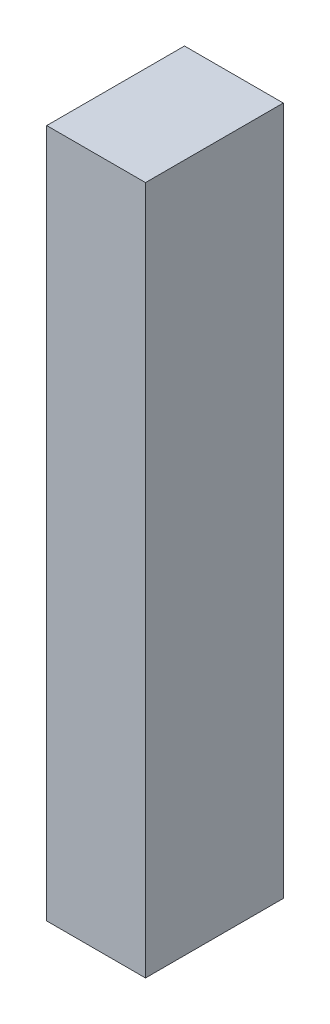
from build123d import *

# Parameters (mm, degrees)
SKETCH2_W           = 71.7
SKETCH2_H           = 100
BOSS_EXTRUDE1_DEPTH = 500


with BuildPart() as part:
    # Sketch2 → Boss-Extrude1 (new body)
    with BuildSketch(Plane(origin=(0, 0, 0), x_dir=(1, 0, 0), z_dir=(0, 1, 0))):
        with Locations((35.85, -50)):
            Rectangle(SKETCH2_W, SKETCH2_H)
    extrude(amount=BOSS_EXTRUDE1_DEPTH)


solid = part.part
